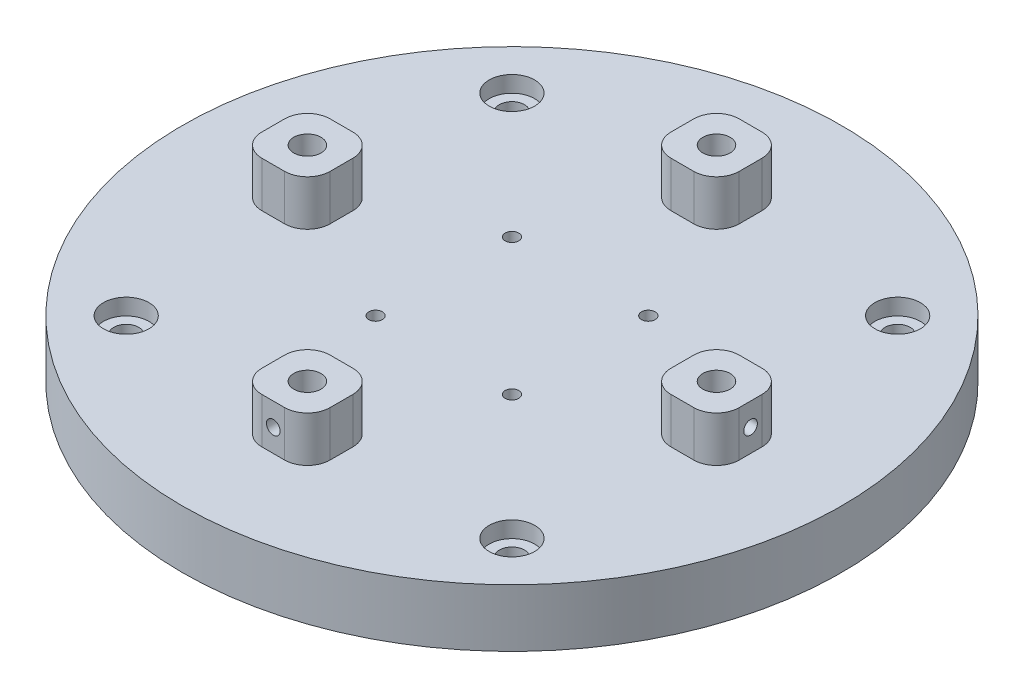
from build123d import *

# Parameters (mm, degrees)
SKETCH1_R                               = 72.5
BOSS_EXTRUDE1_DEPTH                     = 12.7
CBORE_FOR_M5_HEX_HEAD_BOLT2_D           = 5.5
CBORE_FOR_M5_HEX_HEAD_BOLT2_CBORE_D     = 10
CBORE_FOR_M5_HEX_HEAD_BOLT2_CBORE_DEPTH = 3.58
SKETCH11_W                              = 15
SKETCH11_H                              = 15
SKETCH11_R                              = 3
BOSS_EXTRUDE2_DEPTH                     = 10
FILLET1_R                               = 5
CUT_EXTRUDE4_REACH                      = 148.276
CUT_EXTRUDE4_END_RADIUS                 = 3
SKETCH18_R                              = 1.5
CIRPATTERN2_COUNT                       = 4
FILLET1_OF_CIRPATTERN2_R                = 5
SKETCH19_R                              = 1.5
CUT_EXTRUDE5_DEPTH                      = 106.013284895
SKETCH21_R                              = 3.5
CUT_EXTRUDE6_DEPTH                      = 3
SKETCH22_R                              = 15
BOSS_EXTRUDE3_DEPTH                     = 15


with BuildPart() as part:
    # Sketch1 → Boss-Extrude1 (new body)
    with BuildSketch(Plane(origin=(0, 0, 0), x_dir=(1, 0, 0), z_dir=(0, 1, 0))):
        with Locations(Location((0, 0, 0), (0, 0, 270))):
            Circle(SKETCH1_R)
    extrude(amount=BOSS_EXTRUDE1_DEPTH)

    # CBORE for M5 Hex Head Bolt2 (through all)
    with Locations(Plane(origin=(0, 12.7, 0), x_dir=(1, 0, 0), z_dir=(0, 1, 0))):
        with Locations((42.426406871, 42.426406871), (42.426406871, -42.426406871), (-42.426406871, -42.426406871), (-42.426406871, 42.426406871)):
            CounterBoreHole(CBORE_FOR_M5_HEX_HEAD_BOLT2_D / 2, CBORE_FOR_M5_HEX_HEAD_BOLT2_CBORE_D / 2, CBORE_FOR_M5_HEX_HEAD_BOLT2_CBORE_DEPTH)

    # Sketch11 → Boss-Extrude2 (add)
    with BuildSketch(Plane(origin=(0, 12.7, 0), x_dir=(1, 0, 0), z_dir=(0, 1, 0))):
        with Locations((0, -45)):
            Rectangle(SKETCH11_W, SKETCH11_H)
        with Locations(Location((0, -45, 0), (0, 0, 270))):
            Circle(SKETCH11_R, mode=Mode.SUBTRACT)
    boss_extrude2 = extrude(amount=BOSS_EXTRUDE2_DEPTH)

    # Fillet1
    fillet1_edges = [part.edges().sort_by_distance(p)[0] for p in [
        (7.5, 17.7, 52.5),
        (7.5, 17.7, 37.5),
        (-7.5, 17.7, 37.5),
        (-7.5, 17.7, 52.5),
    ]]
    fillet(fillet1_edges, radius=FILLET1_R)

    # Cut-Extrude4: up to this cylinder (the profile starts outside it)
    cut_extrude4_end = Plane(origin=(0, 17.7, 45), z_dir=(0, -1, 0)) * Cylinder(CUT_EXTRUDE4_END_RADIUS, 303.552, mode=Mode.PRIVATE)
    # Sketch18 → Cut-Extrude4 (cut, up to the surface)
    with BuildSketch(Plane.XY.offset(52.5), mode=Mode.PRIVATE) as cut_extrude4_sk1:
        with Locations((0, 17.7)):
            Circle(SKETCH18_R)
    cut_extrude4_tool1 = extrude(cut_extrude4_sk1.sketch, amount=-CUT_EXTRUDE4_REACH, mode=Mode.PRIVATE) - cut_extrude4_end
    cut_extrude4 = cut_extrude4_tool1.solids().sort_by_distance((0, 17.7, 52.5))[0]
    add(cut_extrude4, mode=Mode.SUBTRACT)

    # CirPattern2: Boss-Extrude2, Cut-Extrude4 ×4 about axis
    cirpattern2_axis = Axis((0, 0, 0), (0, 1, 0))
    add([boss_extrude2.rotate(cirpattern2_axis, i * 360 / CIRPATTERN2_COUNT) for i in range(1, CIRPATTERN2_COUNT)])
    add([cut_extrude4.rotate(cirpattern2_axis, i * 360 / CIRPATTERN2_COUNT) for i in range(1, CIRPATTERN2_COUNT)], mode=Mode.SUBTRACT)

    # Fillet1 of CirPattern2
    fillet1_of_cirpattern2_edges = [part.edges().sort_by_distance(p)[0] for p in [
        (52.5, 17.7, -7.5),
        (37.5, 17.7, -7.5),
        (37.5, 17.7, 7.5),
        (52.5, 17.7, 7.5),
        (-7.5, 17.7, -52.5),
        (-7.5, 17.7, -37.5),
        (7.5, 17.7, -37.5),
        (7.5, 17.7, -52.5),
        (-52.5, 17.7, 7.5),
        (-37.5, 17.7, 7.5),
        (-37.5, 17.7, -7.5),
        (-52.5, 17.7, -7.5),
    ]]
    fillet(fillet1_of_cirpattern2_edges, radius=FILLET1_OF_CIRPATTERN2_R)

    # Sketch19 → Cut-Extrude5 (cut, through all)
    with BuildSketch(Plane.XZ):
        with Locations(Location((-15, 15, 0), (0, 0, 270))):
            Circle(SKETCH19_R)
        with Locations(Location((15, 15, 0), (0, 0, 90))):
            Circle(SKETCH19_R)
        with Locations(Location((15, -15, 0), (0, 0, 270))):
            Circle(SKETCH19_R)
        with Locations(Location((-15, -15, 0), (0, 0, 90))):
            Circle(SKETCH19_R)
    extrude(amount=-CUT_EXTRUDE5_DEPTH, mode=Mode.SUBTRACT)

    # Sketch21 → Cut-Extrude6 (cut)
    with BuildSketch(Plane.XZ):
        with Locations(Location((-15, 15, 0), (0, 0, 270))):
            Circle(SKETCH21_R)
        with Locations(Location((15, 15, 0), (0, 0, 90))):
            Circle(SKETCH21_R)
        with Locations(Location((15, -15, 0), (0, 0, 270))):
            Circle(SKETCH21_R)
        with Locations(Location((-15, -15, 0), (0, 0, 90))):
            Circle(SKETCH21_R)
    extrude(amount=-CUT_EXTRUDE6_DEPTH, mode=Mode.SUBTRACT)

    # Sketch22 → Boss-Extrude3 (add)
    with BuildSketch(Plane.XZ):
        with Locations(Location((0, 0, 0), (0, 0, 90))):
            Circle(SKETCH22_R)
    extrude(amount=BOSS_EXTRUDE3_DEPTH)


solid = part.part
